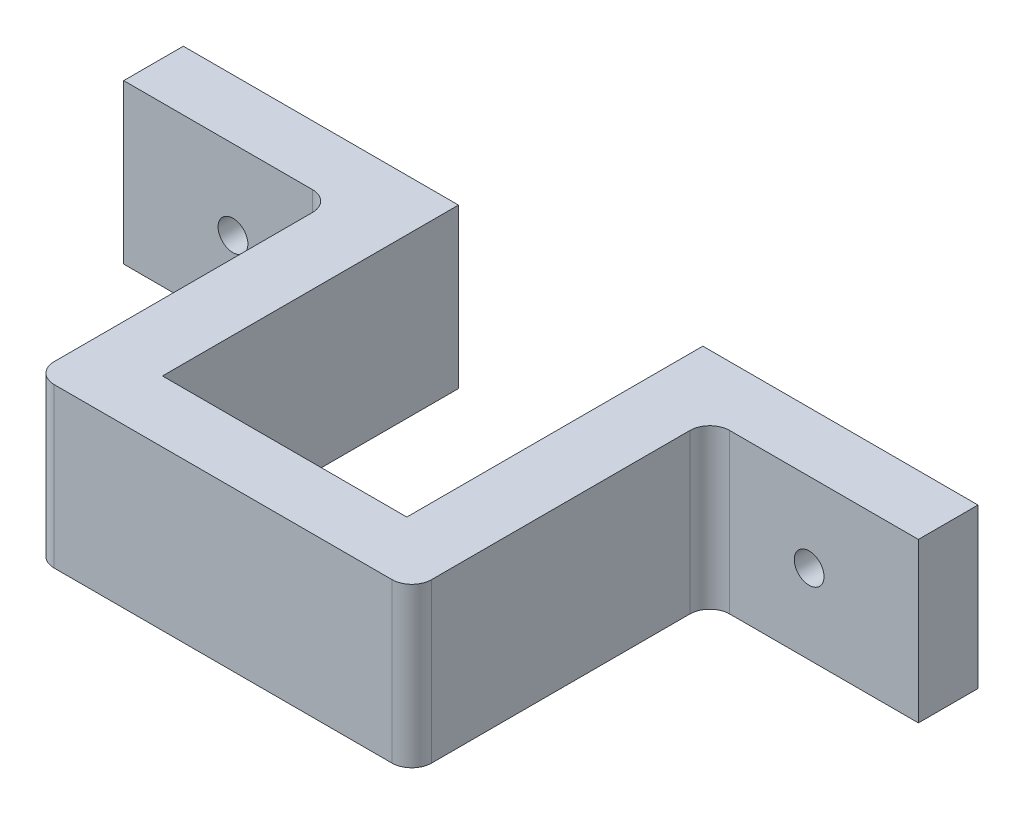
from build123d import *

# Parameters (mm, degrees)
SKETCH1_W           = 40
SKETCH1_H           = 8
SKETCH1_R           = 0.75
BOSS_EXTRUDE1_DEPTH = 3
SKETCH2_W           = 19
SKETCH2_H           = 8
BOSS_EXTRUDE2_DEPTH = 15
SKETCH3_W           = 12.3
SKETCH3_H           = 29.8
CUT_EXTRUDE1_DEPTH  = 8
FILLET1_R           = 1


with BuildPart() as part:
    # Sketch1 → Boss-Extrude1 (new body)
    with BuildSketch(Plane.XY):
        Rectangle(SKETCH1_W, SKETCH1_H)
        with Locations((-14.5, 0)):
            Circle(SKETCH1_R, mode=Mode.SUBTRACT)
        with Locations((14.5, 0)):
            Circle(SKETCH1_R, mode=Mode.SUBTRACT)
    extrude(amount=BOSS_EXTRUDE1_DEPTH)

    # Sketch2 → Boss-Extrude2 (add)
    with BuildSketch(Plane.XY.offset(3)):
        Rectangle(SKETCH2_W, SKETCH2_H)
    extrude(amount=BOSS_EXTRUDE2_DEPTH)

    # Sketch3 → Cut-Extrude1 (cut)
    with BuildSketch(Plane.XZ.offset(4)):
        Rectangle(SKETCH3_W, SKETCH3_H)
    extrude(amount=-CUT_EXTRUDE1_DEPTH, mode=Mode.SUBTRACT)

    # Fillet1
    fillet1_edges = [part.edges().sort_by_distance(p)[0] for p in [
        (-9.5, 0, 3),
        (9.5, 0, 3),
        (-9.5, 0, 18),
        (9.5, 0, 18),
    ]]
    fillet(fillet1_edges, radius=FILLET1_R)


solid = part.part
